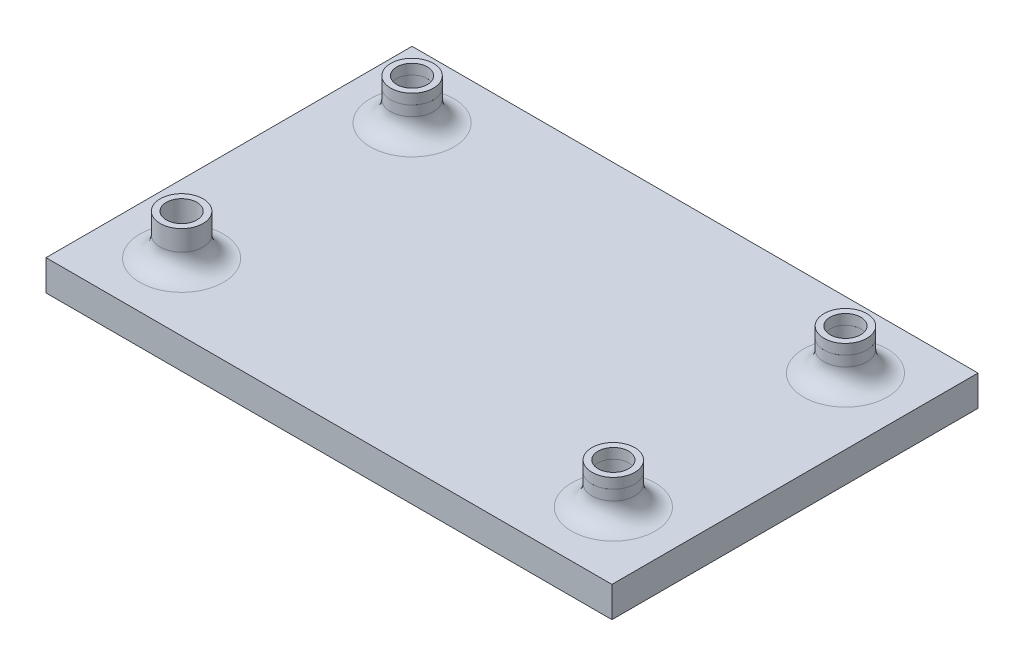
from build123d import *

# Parameters (mm, degrees)
SKETCH2_W             = 60.325
SKETCH2_H             = 35.433
SKETCH2_R             = 1.905
BOSS_EXTRUDE1_DEPTH   = 3.81
SKETCH4_R             = 2.667
SKETCH4_R_2           = 1.905
BOSS_EXTRUDE3_DEPTH   = 3.81
BOSS_EXTRUDE3_2_DEPTH = 3.81
BOSS_EXTRUDE3_3_DEPTH = 3.81
BOSS_EXTRUDE3_4_DEPTH = 3.81
SKETCH6_R             = 2.667
SKETCH6_R_2           = 1.905
BOSS_EXTRUDE4_DEPTH   = 1.27
SKETCH7_W             = 70.485
SKETCH7_H             = 45.593
SKETCH7_W_2           = 60.325
SKETCH7_H_2           = 35.433
BOSS_EXTRUDE5_DEPTH   = 3.81
FILLET5_R             = 2.54
FILLET7_R             = 2.54
FILLET8_R             = 2.54
FILLET9_R             = 2.54


with BuildPart() as part:
    # Sketch2 → Boss-Extrude1 (new body)
    with BuildSketch(Plane(origin=(0, 0, 0), x_dir=(1, 0, 0), z_dir=(0, 1, 0))):
        with Locations((30.1625, 17.7165)):
            Rectangle(SKETCH2_W, SKETCH2_H)
        with Locations(Location((57.15, 32.258, 0), (0, 0, 90))):
            Circle(SKETCH2_R, mode=Mode.SUBTRACT)
        with Locations(Location((57.15, 3.35191596, 0), (0, 0, 90))):
            Circle(SKETCH2_R, mode=Mode.SUBTRACT)
        with Locations(Location((3.175, 32.258, 0), (0, 0, 90))):
            Circle(SKETCH2_R, mode=Mode.SUBTRACT)
        with Locations(Location((3.429, 3.302, 0), (0, 0, 90))):
            Circle(SKETCH2_R, mode=Mode.SUBTRACT)
    extrude(amount=BOSS_EXTRUDE1_DEPTH)



with BuildPart() as body_2:
    # Sketch4 → Boss-Extrude3 (new body)
    with BuildSketch(Plane(origin=(0, 3.81, 0), x_dir=(1, 0, 0), z_dir=(0, 1, 0))):
        with Locations(Location((3.175, 32.258, 0), (0, 0, 90))):
            Circle(SKETCH4_R)
        with Locations(Location((3.175, 32.258, 0), (0, 0, 90))):
            Circle(SKETCH4_R_2, mode=Mode.SUBTRACT)
    extrude(amount=BOSS_EXTRUDE3_DEPTH)


with BuildPart() as body_3:
    # Sketch4 → Boss-Extrude3 2 (new body)
    with BuildSketch(Plane(origin=(0, 3.81, 0), x_dir=(1, 0, 0), z_dir=(0, 1, 0))):
        with Locations(Location((57.15, 32.258, 0), (0, 0, 90))):
            Circle(SKETCH4_R)
        with Locations(Location((57.15, 32.258, 0), (0, 0, 90))):
            Circle(SKETCH4_R_2, mode=Mode.SUBTRACT)
    extrude(amount=BOSS_EXTRUDE3_2_DEPTH)


with BuildPart() as body_4:
    # Sketch4 → Boss-Extrude3 3 (new body)
    with BuildSketch(Plane(origin=(0, 3.81, 0), x_dir=(1, 0, 0), z_dir=(0, 1, 0))):
        with Locations(Location((57.15, 3.35191596, 0), (0, 0, 90))):
            Circle(SKETCH4_R)
        with Locations(Location((57.15, 3.35191596, 0), (0, 0, 90))):
            Circle(SKETCH4_R_2, mode=Mode.SUBTRACT)
    extrude(amount=BOSS_EXTRUDE3_3_DEPTH)


with BuildPart() as body_5:
    # Sketch4 → Boss-Extrude3 4 (new body)
    with BuildSketch(Plane(origin=(0, 3.81, 0), x_dir=(1, 0, 0), z_dir=(0, 1, 0))):
        with Locations(Location((3.429, 3.302, 0), (0, 0, 90))):
            Circle(SKETCH4_R)
        with Locations(Location((3.429, 3.302, 0), (0, 0, 90))):
            Circle(SKETCH4_R_2, mode=Mode.SUBTRACT)
    extrude(amount=BOSS_EXTRUDE3_4_DEPTH)

    # Sketch6 → Boss-Extrude4 (add)
    # profile 1 of 4: a face of its own
    with BuildSketch(Plane(origin=(0, 7.62, 0), x_dir=(1, 0, 0), z_dir=(0, 1, 0))):
        with Locations(Location((3.429, 3.302, 0), (0, 0, 90))):
            Circle(SKETCH6_R)
        with Locations(Location((3.429, 3.302, 0), (0, 0, 90))):
            Circle(SKETCH6_R_2, mode=Mode.SUBTRACT)
    # profile 2 of 4: a face of its own
    with BuildSketch(Plane(origin=(0, 7.62, 0), x_dir=(1, 0, 0), z_dir=(0, 1, 0))):
        with Locations(Location((3.175, 32.258, 0), (0, 0, 270))):
            Circle(SKETCH6_R)
        with Locations(Location((3.175, 32.258, 0), (0, 0, 270))):
            Circle(SKETCH6_R_2, mode=Mode.SUBTRACT)
    # profile 3 of 4: a face of its own
    with BuildSketch(Plane(origin=(0, 7.62, 0), x_dir=(1, 0, 0), z_dir=(0, 1, 0))):
        with Locations(Location((57.15, 32.258, 0), (0, 0, 270))):
            Circle(SKETCH6_R)
        with Locations(Location((57.15, 32.258, 0), (0, 0, 270))):
            Circle(SKETCH6_R_2, mode=Mode.SUBTRACT)
    # profile 4 of 4: a face of its own
    with BuildSketch(Plane(origin=(0, 7.62, 0), x_dir=(1, 0, 0), z_dir=(0, 1, 0))):
        with Locations(Location((57.15, 3.35191596, 0), (0, 0, 270))):
            Circle(SKETCH6_R)
        with Locations(Location((57.15, 3.35191596, 0), (0, 0, 270))):
            Circle(SKETCH6_R_2, mode=Mode.SUBTRACT)
    extrude(amount=BOSS_EXTRUDE4_DEPTH)


with BuildPart() as boss_extrude4_piece_1:
    # of the separate pieces the step leaves, piece 1, a body of its own (boss_extrude4_pieces)
    add(body_5.part.solids().sort_by_distance((3.429, 3.81, -5.969))[0])


with BuildPart() as boss_extrude4_piece_2:
    # of the separate pieces the step leaves, piece 2, a body of its own (boss_extrude4_pieces)
    add(body_5.part.solids().sort_by_distance((57.15, 7.62, -0.68491596))[0])


with BuildPart() as boss_extrude4_piece_3:
    # of the separate pieces the step leaves, piece 3, a body of its own (boss_extrude4_pieces)
    add(body_5.part.solids().sort_by_distance((57.15, 7.62, -29.591))[0])


with BuildPart() as boss_extrude4_piece_4:
    # of the separate pieces the step leaves, piece 4, a body of its own (boss_extrude4_pieces)
    add(body_5.part.solids().sort_by_distance((3.175, 7.62, -29.591))[0])


with BuildPart() as part_1:
    add(part.part)

    add(body_2.part)  # Boss-Extrude5 merges body 2

    add(body_3.part)  # Boss-Extrude5 merges body 3

    add(body_4.part)  # Boss-Extrude5 merges body 4

    add(boss_extrude4_piece_1.part)  # Boss-Extrude5 merges Boss-Extrude4 piece 1
    # Sketch7 → Boss-Extrude5 (add)
    with BuildSketch(Plane(origin=(0, 3.81, 0), x_dir=(1, 0, 0), z_dir=(0, 1, 0))):
        with Locations((30.1625, 17.7165)):
            Rectangle(SKETCH7_W, SKETCH7_H)
        with Locations((30.1625, 17.7165)):
            Rectangle(SKETCH7_W_2, SKETCH7_H_2, mode=Mode.SUBTRACT)
    extrude(amount=-BOSS_EXTRUDE5_DEPTH)

    # Fillet5
    fillet5_edges = [part_1.edges().sort_by_distance(p)[0] for p in [
        (3.175, 3.81, -29.591),
    ]]
    fillet(fillet5_edges, radius=FILLET5_R)

    # Fillet7
    fillet7_edges = [part_1.edges().sort_by_distance(p)[0] for p in [
        (3.429, 3.81, -0.635),
    ]]
    fillet(fillet7_edges, radius=FILLET7_R)

    # Fillet8
    fillet8_edges = [part_1.edges().sort_by_distance(p)[0] for p in [
        (57.15, 3.81, -0.68491596),
    ]]
    fillet(fillet8_edges, radius=FILLET8_R)

    # Fillet9
    fillet9_edges = [part_1.edges().sort_by_distance(p)[0] for p in [
        (57.15, 3.81, -29.591),
    ]]
    fillet(fillet9_edges, radius=FILLET9_R)


solid = Compound([boss_extrude4_piece_2.part, boss_extrude4_piece_3.part, boss_extrude4_piece_4.part, part_1.part])
